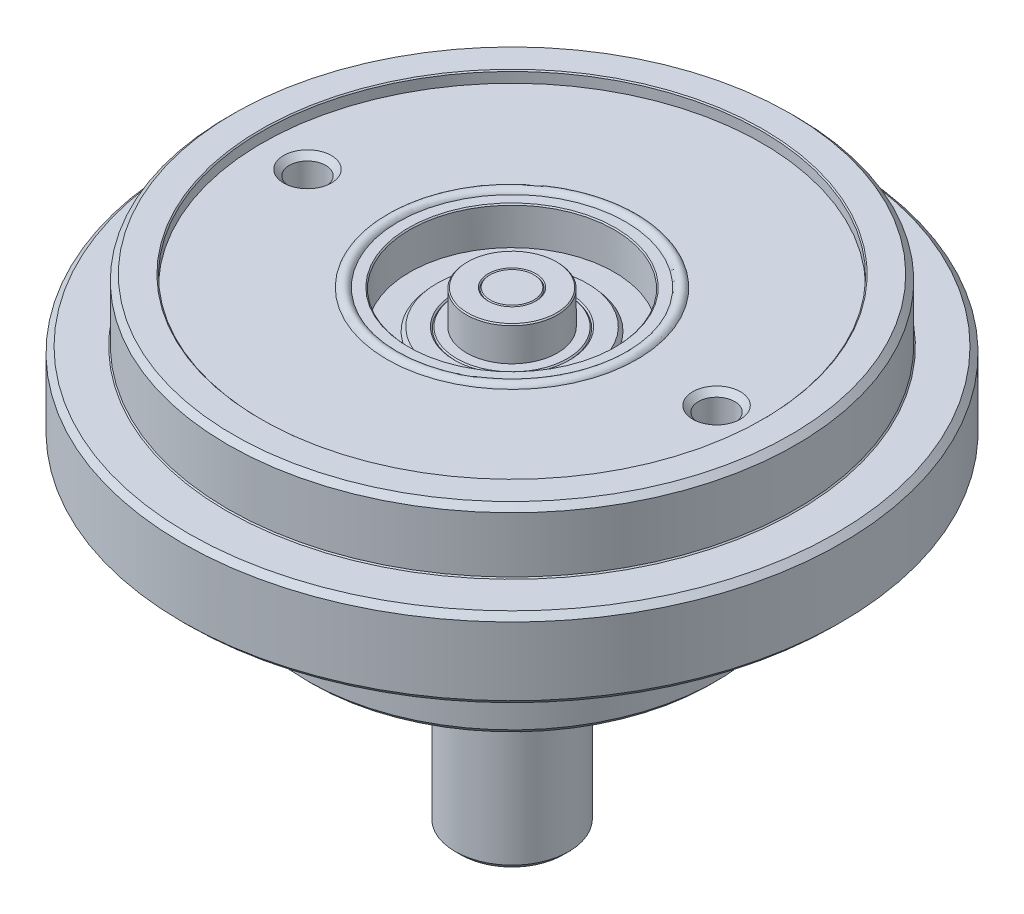
from build123d import *

# Parameters (mm, degrees)
SKETCH2_R          = 1.6
CUT_EXTRUDE2_DEPTH = 6
SKETCH4_R          = 1.2
CUT_EXTRUDE4_DEPTH = 5
CHAMFER1_SIZE      = 0.5
CHAMFER3_SIZE      = 0.1


with BuildPart() as part:
    # Sketch1 → Revolve4 (revolve)
    with BuildSketch(Plane.XY, mode=Mode.PRIVATE) as revolve4_sk:
        with BuildLine():
            Line((844.943210176, 281.38888375), (845.428519032, 280.88888375))
            Line((845.428519032, 280.88888375), (849.942387276, 280.88888375))
            Line((849.942387276, 280.88888375), (849.942387276, 290.88888375))
            Line((849.942387276, 290.88888375), (860.942387276, 290.88888375))
            Line((860.942387276, 290.88888375), (860.942387276, 297.88888375))
            Line((860.942387276, 297.88888375), (856.942387276, 297.88888375))
            Line((856.942387276, 297.88888375), (856.942387276, 303.38888375))
            Line((856.942387276, 303.38888375), (853.942387276, 303.38888375))
            Line((853.942387276, 303.38888375), (853.942387276, 302.38888375))
            Line((853.942387276, 302.38888375), (842.942387276, 302.38888375))
            ThreePointArc((842.942387276, 302.38888375), (842.442387276, 302.71356783), (841.942387276, 302.38888375))
            Line((841.942387276, 302.38888375), (840.942387276, 302.38888375))
            Line((840.942387276, 302.38888375), (840.942387276, 299.054998182))
            Line((840.942387276, 299.054998182), (838.850052202, 299.054998182))
            Line((838.850052202, 299.054998182), (838.556543661, 299.38888375))
            Line((838.556543661, 299.38888375), (837.02254839, 299.38888375))
            Line((837.02254839, 299.38888375), (836.904667291, 299.280121777))
            Line((836.904667291, 299.280121777), (836.804319001, 299.38888375))
            Line((836.804319001, 299.38888375), (835.942387276, 299.38888375))
            Line((835.942387276, 299.38888375), (835.942387276, 302.38888375))
            Line((835.942387276, 302.38888375), (834.038239304, 302.38888375))
            Line((834.038239304, 302.38888375), (833.942387276, 302.301556661))
            Line((833.942387276, 302.301556661), (833.862826931, 302.38888375))
            Line((833.862826931, 302.38888375), (831.942387276, 302.38888375))
            Line((831.942387276, 302.38888375), (831.942387276, 261.38888375))
            Line((831.942387276, 261.38888375), (836.942387276, 261.38888375))
            Line((836.942387276, 261.38888375), (836.942387276, 281.38888375))
            Line((836.942387276, 281.38888375), (838.542387276, 281.38888375))
            Line((838.542387276, 281.38888375), (838.791787089, 281.619745582))
            Line((838.791787089, 281.619745582), (843.015951121, 281.619745582))
            Line((843.015951121, 281.619745582), (843.343210176, 281.38888375))
            Line((843.343210176, 281.38888375), (844.943210176, 281.38888375))
        make_face()
    revolve(revolve4_sk.sketch.rotate(Axis((831.942387276, 300.670444461, 0), (0, -1, 0)), 90), axis=Axis((831.942387276, 300.670444461, 0), (0, -1, 0)))

    # Sketch2 → Cut-Extrude2 (cut)
    with BuildSketch(Plane(origin=(0, 302.38888375, 0), x_dir=(-1, 0, 0), z_dir=(0, 1, 0))):
        with Locations(Location((-849.942387276, 0, 0), (0, 0, 90))):
            Circle(SKETCH2_R)
        with Locations(Location((-813.942387276, 0, 0), (0, 0, 90))):
            Circle(SKETCH2_R)
    extrude(amount=-CUT_EXTRUDE2_DEPTH, mode=Mode.SUBTRACT)

    # Cut-Extrude3 cone 1 section (through the dimple's axis) → Cut-Extrude3 (revolve, cut)
    with BuildSketch(Plane(origin=(849.942387276, 296.38888375, 0), x_dir=(0, 0, 1), z_dir=(1, 0, 0))):
        Polygon((0, 0), (1.6, 0), (0, 1.120332061), align=None)
    revolve(axis=Axis((849.942387276, 296.38888375, 0), (0, -1, 0)), mode=Mode.SUBTRACT)

    # Cut-Extrude3 cone 2 section (through the dimple's axis) → Cut-Extrude3 cone 2 (revolve, cut)
    with BuildSketch(Plane(origin=(813.942387276, 296.38888375, 0), x_dir=(0, 0, 1), z_dir=(1, 0, 0))):
        Polygon((0, 0), (1.6, 0), (0, 1.120332061), align=None)
    revolve(axis=Axis((813.942387276, 296.38888375, 0), (0, -1, 0)), mode=Mode.SUBTRACT)

    # Sketch4 → Cut-Extrude4 (cut)
    with BuildSketch(Plane.XZ.offset(-290.88888375)):
        with Locations(Location((831.942387276, -24, 0), (0, 0, 270))):
            Circle(SKETCH4_R)
        with Locations(Location((811.157777585, 12, 0), (0, 0, 270))):
            Circle(SKETCH4_R)
        with Locations(Location((852.726996967, 12, 0), (0, 0, 270))):
            Circle(SKETCH4_R)
    extrude(amount=-CUT_EXTRUDE4_DEPTH, mode=Mode.SUBTRACT)

    # Cut-Extrude5 cone 1 section (through the dimple's axis) → Cut-Extrude5 (revolve, cut)
    with BuildSketch(Plane(origin=(831.942387276, 295.88888375, -24), x_dir=(0, 0, -1), z_dir=(1, 0, 0))):
        Polygon((0, 0), (1.2, 0), (0, 0.840249046), align=None)
    revolve(axis=Axis((831.942387276, 295.88888375, -24), (0, 1, 0)), mode=Mode.SUBTRACT)

    # Cut-Extrude5 cone 2 section (through the dimple's axis) → Cut-Extrude5 cone 2 (revolve, cut)
    with BuildSketch(Plane(origin=(852.726996967, 295.88888375, 12), x_dir=(0, 0, -1), z_dir=(1, 0, 0))):
        Polygon((0, 0), (1.2, 0), (0, 0.840249046), align=None)
    revolve(axis=Axis((852.726996967, 295.88888375, 12), (0, 1, 0)), mode=Mode.SUBTRACT)

    # Cut-Extrude5 cone 3 section (through the dimple's axis) → Cut-Extrude5 cone 3 (revolve, cut)
    with BuildSketch(Plane(origin=(811.157777585, 295.88888375, 12), x_dir=(0, 0, -1), z_dir=(1, 0, 0))):
        Polygon((0, 0), (1.2, 0), (0, 0.840249046), align=None)
    revolve(axis=Axis((811.157777585, 295.88888375, 12), (0, 1, 0)), mode=Mode.SUBTRACT)

    # Chamfer1
    chamfer1_edges = [part.edges().sort_by_distance(p)[0] for p in [
        (831.942387276, 303.38888375, -25),
        (831.942387276, 297.88888375, -29),
        (831.942387276, 290.88888375, -29),
        (831.942387276, 280.88888375, -18),
        (831.942387276, 261.38888375, -5),
        (849.942387276, 302.38888375, -1.6),
        (813.942387276, 302.38888375, -1.6),
        (831.942387276, 290.88888375, -22.8),
        (811.157777585, 290.88888375, 13.2),
        (852.726996967, 290.88888375, 13.2),
    ]]
    chamfer(chamfer1_edges, length=CHAMFER1_SIZE)

    # Chamfer3
    chamfer3_edges = [part.edges().sort_by_distance(p)[0] for p in [
        (831.942387276, 302.38888375, -4),
        (831.942387276, 302.38888375, -9),
        (831.942387276, 303.38888375, -22),
        (831.942387276, 297.88888375, -25),
        (831.942387276, 290.88888375, -18),
    ]]
    chamfer(chamfer3_edges, length=CHAMFER3_SIZE)


solid = part.part
